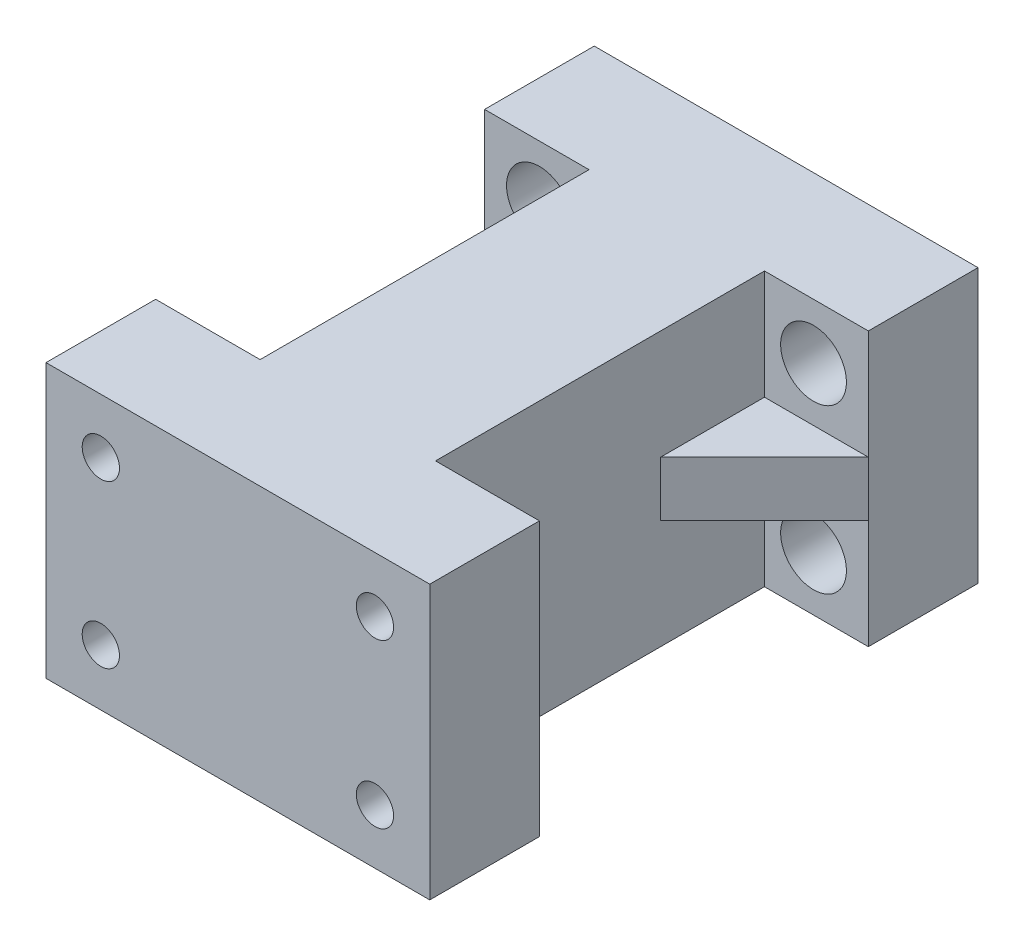
from build123d import *

# Parameters (mm, degrees)
SKETCH2_R           = 1.7
BOSS_EXTRUDE1_DEPTH = 50
CUT_EXTRUDE1_DEPTH  = 51
CUT_EXTRUDE2_START  = -22.181644
SKETCH4_R           = 4.1
CUT_EXTRUDE2_DEPTH  = 22.181644
CUT_EXTRUDE3_START  = -6
SKETCH6_R           = 3
SKETCH6_R_2         = 1.7
CUT_EXTRUDE3_DEPTH  = 6
BOSS_EXTRUDE2_DEPTH = 2.5


with BuildPart() as part:
    # Sketch2 → Boss-Extrude1 (new body)
    with BuildSketch(Plane.XY):
        Polygon((29.223766163, 230.865012057), (29.223766163, 235.92362241), (24.223766163, 235.92362241), (-0.776233837, 235.92362241), (-5.776233837, 235.92362241), (-5.776233837, 230.92362241), (-5.776233837, 210.982238102), (24.223766163, 210.982238102), (29.223766163, 210.982238102), (29.223766163, 215.982238102), align=None)
        with Locations((-0.776233837, 216.130599455)):
            Circle(SKETCH2_R, mode=Mode.SUBTRACT)
        with Locations((24.223766163, 215.982238102)):
            Circle(SKETCH2_R, mode=Mode.SUBTRACT)
        with Locations((-0.776233837, 230.92362241)):
            Circle(SKETCH2_R, mode=Mode.SUBTRACT)
        with Locations((24.223766163, 230.865012057)):
            Circle(SKETCH2_R, mode=Mode.SUBTRACT)
    extrude(amount=BOSS_EXTRUDE1_DEPTH)

    # Sketch3 → Cut-Extrude1 (cut)
    with BuildSketch(Plane(origin=(0, 235.92362241, 0), x_dir=(1, 0, 0), z_dir=(0, 1, 0))):
        Polygon((3.750473292, -40), (3.750473292, -27), (3.750473292, -10), (-5.776233837, -10), (-5.776233837, -40), align=None)
        Polygon((29.223766163, -10), (19.750473292, -10), (19.750473292, -27), (19.750473292, -40), (29.223766163, -40), align=None)
    extrude(amount=-CUT_EXTRUDE1_DEPTH, mode=Mode.SUBTRACT)

    # Sketch4 → Cut-Extrude2 (cut)
    with BuildSketch(Plane.XZ.offset(-210.982238102).offset(CUT_EXTRUDE2_START)):
        with Locations(Location((11.743125017, 25.37, 0), (0, 0, 270))):
            Circle(SKETCH4_R)
    extrude(amount=CUT_EXTRUDE2_DEPTH, mode=Mode.SUBTRACT)

    # Sketch6 → Cut-Extrude3 (cut)
    # profile 1 of 4: a face of its own
    with BuildSketch(Plane.XY.offset(10).offset(CUT_EXTRUDE3_START)):
        with Locations((24.223766163, 230.865012057)):
            Circle(SKETCH6_R)
    # profile 2 of 4: a face of its own
    with BuildSketch(Plane.XY.offset(10).offset(CUT_EXTRUDE3_START)):
        with Locations((24.223766163, 215.982238102)):
            Circle(SKETCH6_R)
        with Locations((24.223766163, 215.982238102)):
            Circle(SKETCH6_R_2, mode=Mode.SUBTRACT)
    # profile 3 of 4: a face of its own
    with BuildSketch(Plane.XY.offset(10).offset(CUT_EXTRUDE3_START)):
        with Locations((-0.776233837, 216.130599455)):
            Circle(SKETCH6_R)
        with Locations((-0.776233837, 216.130599455)):
            Circle(SKETCH6_R_2, mode=Mode.SUBTRACT)
    # profile 4 of 4: a face of its own
    with BuildSketch(Plane.XY.offset(10).offset(CUT_EXTRUDE3_START)):
        with Locations((-0.776233837, 230.92362241)):
            Circle(SKETCH6_R)
        with Locations((-0.776233837, 230.92362241)):
            Circle(SKETCH6_R_2, mode=Mode.SUBTRACT)
    extrude(amount=CUT_EXTRUDE3_DEPTH, mode=Mode.SUBTRACT)

    # Sketch8 → Boss-Extrude2 (add, symmetric)
    with BuildSketch(Plane(origin=(0, 223.452930256, 0), x_dir=(1, 0, 0), z_dir=(0, 1, 0))):
        Polygon((3.750473292, -30.597830669), (-5.651696039, -40), (3.750473292, -40), align=None)
        Polygon((19.750473292, -40), (29.223766163, -40), (19.750473292, -30.52670713), align=None)
        Polygon((19.750473292, -10), (19.750473292, -19.47329287), (29.223766163, -10), align=None)
        Polygon((3.750473292, -10), (-5.776233837, -10), (3.750473292, -19.52670713), align=None)
    extrude(amount=BOSS_EXTRUDE2_DEPTH, both=True)


solid = part.part
